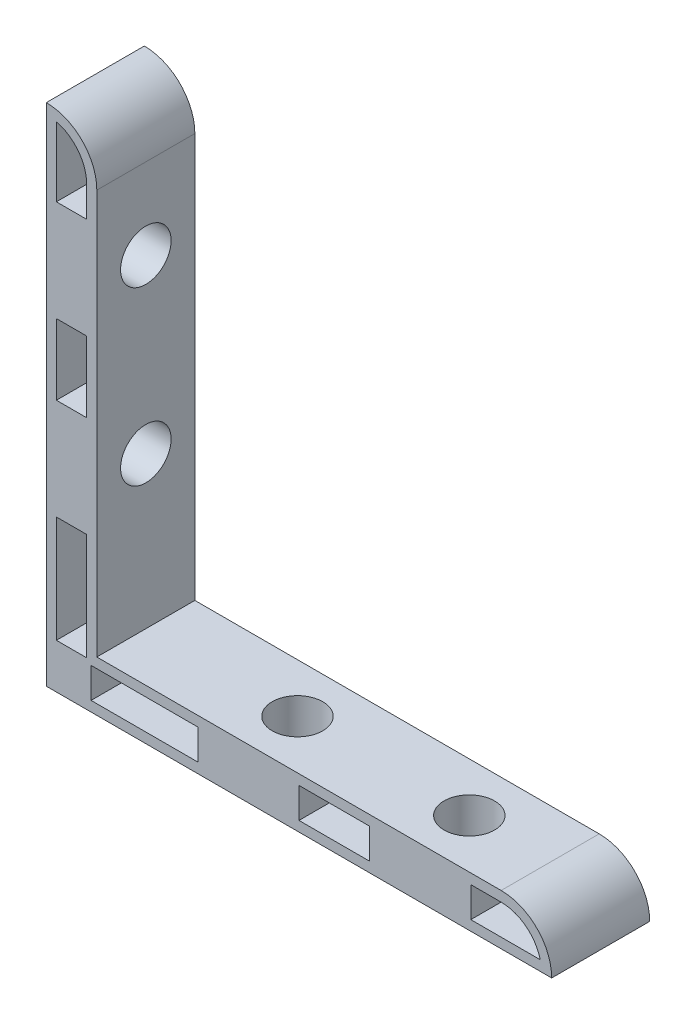
from build123d import *

# Parameters (mm, degrees)
EXTRUDE_1_DEPTH        = 4.85
HOLE_WIZARD_M6_1_D     = 5
HOLE_WIZARD_M6_1_DEPTH = 23
HOLE_WIZARD_M6_1_TIP   = 1.502151548
HOLE_WIZARD_M6_2_D     = 5
HOLE_WIZARD_M6_2_DEPTH = 23
HOLE_WIZARD_M6_2_TIP   = 1.502151548
SKETCH_7_W             = 3
SKETCH_7_H             = 10.567492921
SKETCH_7_W_2           = 10.567492921
SKETCH_7_H_2           = 3
SKETCH_7_W_3           = 7
SKETCH_7_H_3           = 7
CUT_EXTRUDE_1_DEPTH    = 3
CUT_EXTRUDE_START      = -3
SKETCH_8_W             = 3
SKETCH_8_H             = 10.567492921
SKETCH_8_H_2           = 7
SKETCH_8_W_2           = 10.567492921
SKETCH_8_H_3           = 3
SKETCH_8_W_3           = 7
CUT_EXTRUDE_2_DEPTH    = 3


with BuildPart() as part:
    # 草图1 → 凸台-拉伸1 (new, symmetric)
    with BuildSketch(Plane.XY):
        with BuildLine():
            Line((0, 50), (0, 0))
            Line((0, 0), (50, 0))
            ThreePointArc((50, 0), (48.535533906, 3.535533906), (45, 5))
            Line((45, 5), (5, 5))
            Line((5, 5), (5, 45))
            ThreePointArc((5, 45), (3.535533906, 48.535533906), (0, 50))
        make_face()
    extrude(amount=EXTRUDE_1_DEPTH, both=True)

    # M6 螺纹孔1
    with Locations(Plane(origin=(5, 37, 0), x_dir=(0, 0, 1), z_dir=(1, 0, 0))):
        with Locations((0, 0), (0, 17)):
            Hole(HOLE_WIZARD_M6_1_D / 2, depth=HOLE_WIZARD_M6_1_DEPTH)
            with Locations((0, 0, -(HOLE_WIZARD_M6_1_DEPTH + HOLE_WIZARD_M6_1_TIP / 2))):  # 118° drill point
                Cone(0, HOLE_WIZARD_M6_1_D / 2, HOLE_WIZARD_M6_1_TIP, mode=Mode.SUBTRACT)

    # M6 螺纹孔2
    with Locations(Plane(origin=(20, 5, 0), x_dir=(0, 0, 1), z_dir=(0, 1, 0))):
        with Locations((0, 0), (0, 17)):
            Hole(HOLE_WIZARD_M6_2_D / 2, depth=HOLE_WIZARD_M6_2_DEPTH)
            with Locations((0, 0, -(HOLE_WIZARD_M6_2_DEPTH + HOLE_WIZARD_M6_2_TIP / 2))):  # 118° drill point
                Cone(0, HOLE_WIZARD_M6_2_D / 2, HOLE_WIZARD_M6_2_TIP, mode=Mode.SUBTRACT)

    # 草图7 → 切除-拉伸1 (cut)
    with BuildSketch(Plane(origin=(0, 0, -4.85), x_dir=(-1, 0, 0), z_dir=(0, 0, -1))):
        with Locations((-2.5, 9.71625354)):
            Rectangle(SKETCH_7_W, SKETCH_7_H)
        with Locations((-9.71625354, 2.5)):
            Rectangle(SKETCH_7_W_2, SKETCH_7_H_2)
        with BuildLine():
            Line((-4, 42), (-1, 42))
            Line((-1, 42), (-1, 48.872983346))
            ThreePointArc((-1, 48.872983346), (-3.16227766, 47.449489743), (-4, 45))
            Line((-4, 45), (-4, 42))
        make_face()
        with BuildLine():
            Line((-42, 4), (-42, 1))
            Line((-42, 1), (-48.872983346, 1))
            ThreePointArc((-48.872983346, 1), (-47.449489743, 3.16227766), (-45, 4))
            Line((-45, 4), (-42, 4))
        make_face()
        with Locations((-28.5, 2.5)):
            Rectangle(SKETCH_7_W_3, SKETCH_7_H_2)
        with Locations((-2.5, 28.5)):
            Rectangle(SKETCH_7_W, SKETCH_7_H_3)
    extrude(amount=-CUT_EXTRUDE_1_DEPTH, mode=Mode.SUBTRACT)

    # 草图8 → 切除-拉伸2 (cut)
    with BuildSketch(Plane.XY.offset(4.85).offset(CUT_EXTRUDE_START)):
        with BuildLine():
            Line((1, 42), (1, 48.872983346))
            ThreePointArc((1, 48.872983346), (3.16227766, 47.449489743), (4, 45))
            Line((4, 45), (4, 42))
            Line((4, 42), (1, 42))
        make_face()
        with BuildLine():
            Line((42, 4), (45, 4))
            ThreePointArc((45, 4), (47.449489743, 3.16227766), (48.872983346, 1))
            Line((48.872983346, 1), (42, 1))
            Line((42, 1), (42, 4))
        make_face()
        with Locations((2.5, 9.71625354)):
            Rectangle(SKETCH_8_W, SKETCH_8_H)
        with Locations((2.5, 28.5)):
            Rectangle(SKETCH_8_W, SKETCH_8_H_2)
        with Locations((9.71625354, 2.5)):
            Rectangle(SKETCH_8_W_2, SKETCH_8_H_3)
        with Locations((28.5, 2.5)):
            Rectangle(SKETCH_8_W_3, SKETCH_8_H_3)
    extrude(amount=CUT_EXTRUDE_2_DEPTH, mode=Mode.SUBTRACT)


solid = part.part
